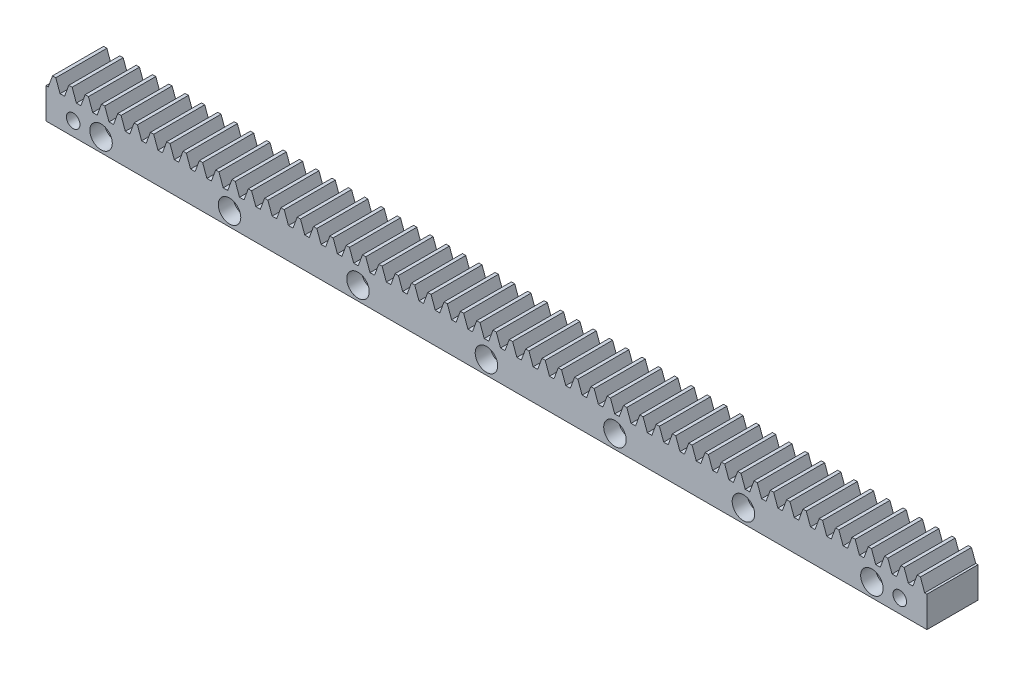
from build123d import *

# Parameters (mm, degrees)
BLANKSKE_W         = 1017.88
BLANKSKE_H         = 49
BLANK_DEPTH        = 59
TOOTHCUTSIM_DEPTH  = 1021.765249409
TEETHCUTS_COUNT    = 55
TEETHCUTS_PITCH    = 18.8495559
SKETCH2_R          = 7.85
CUT_EXTRUDE1_DEPTH = 202
SKETCH3_R          = 9
CUT_EXTRUDE2_DEPTH = 202
SKETCH4_R          = 13
CUT_EXTRUDE3_DEPTH = 17
LPATTERN1_COUNT    = 2
LPATTERN1_PITCH    = 890.68
LPATTERN2_COUNT    = 6
LPATTERN2_PITCH    = 148.44666


with BuildPart() as part:
    # BlankSke → Blank (new body)
    with BuildSketch(Plane.XY):
        with Locations((508.94, 24.5)):
            Rectangle(BLANKSKE_W, BLANKSKE_H)
    extrude(amount=-BLANK_DEPTH)

    # TooCutSkeSim → ToothCutSim (cut, through all)
    with BuildSketch(Plane.XY):
        Polygon((2.603612218, 35.5), (-2.603612218, 35.5), (-7.526455225, 49.0254), (7.526455225, 49.0254), align=None)
    toothcutsim = extrude(amount=-TOOTHCUTSIM_DEPTH, mode=Mode.SUBTRACT)

    # TeethCuts: ToothCutSim ×55
    with Locations(*[(i * TEETHCUTS_PITCH, 0, 0) for i in range(1, TEETHCUTS_COUNT)]):
        add(toothcutsim, mode=Mode.SUBTRACT)

    # Sketch2 → Cut-Extrude1 (cut)
    with BuildSketch(Plane.XY):
        with Locations((31.4, 16)):
            Circle(SKETCH2_R)
        with Locations((986.48, 16)):
            Circle(SKETCH2_R)
    extrude(amount=-CUT_EXTRUDE1_DEPTH, mode=Mode.SUBTRACT)

    # Sketch3 → Cut-Extrude2 (cut)
    with BuildSketch(Plane.XY):
        with Locations((63.6, 16)):
            Circle(SKETCH3_R)
    cut_extrude2 = extrude(amount=-CUT_EXTRUDE2_DEPTH, mode=Mode.SUBTRACT)

    # Sketch4 → Cut-Extrude3 (cut)
    with BuildSketch(Plane.XY):
        with Locations((63.6, 16)):
            Circle(SKETCH4_R)
    cut_extrude3 = extrude(amount=-CUT_EXTRUDE3_DEPTH, mode=Mode.SUBTRACT)

    # LPattern1: Cut-Extrude2, Cut-Extrude3 ×2
    with Locations(*[(i * LPATTERN1_PITCH, 0, 0) for i in range(1, LPATTERN1_COUNT)]):
        add(cut_extrude2, mode=Mode.SUBTRACT)
        add(cut_extrude3, mode=Mode.SUBTRACT)

    # LPattern2: Cut-Extrude2, Cut-Extrude3 ×6
    with Locations(*[(i * LPATTERN2_PITCH, 0, 0) for i in range(1, LPATTERN2_COUNT)]):
        add(cut_extrude2, mode=Mode.SUBTRACT)
        add(cut_extrude3, mode=Mode.SUBTRACT)


solid = part.part
